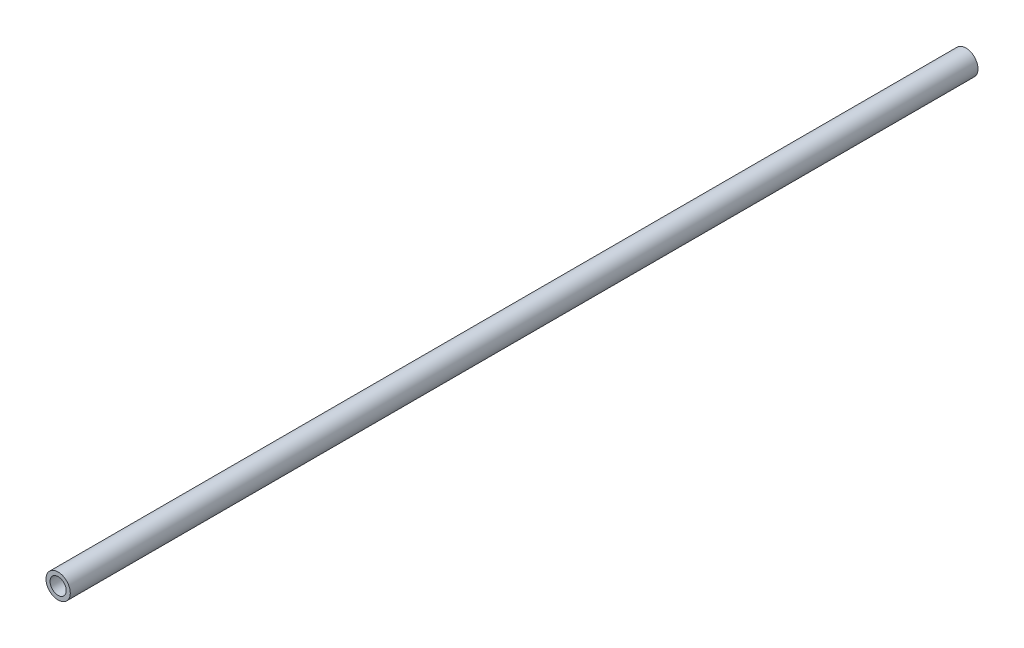
from build123d import *

# Parameters (mm, degrees)
SKETCH2_R           = 7.5
SKETCH2_R_2         = 5
BOSS_EXTRUDE1_DEPTH = 560


with BuildPart() as part:
    # Sketch2 → Boss-Extrude1 (new body)
    with BuildSketch(Plane.XY):
        Circle(SKETCH2_R)
        Circle(SKETCH2_R_2, mode=Mode.SUBTRACT)
    extrude(amount=BOSS_EXTRUDE1_DEPTH)


solid = part.part
